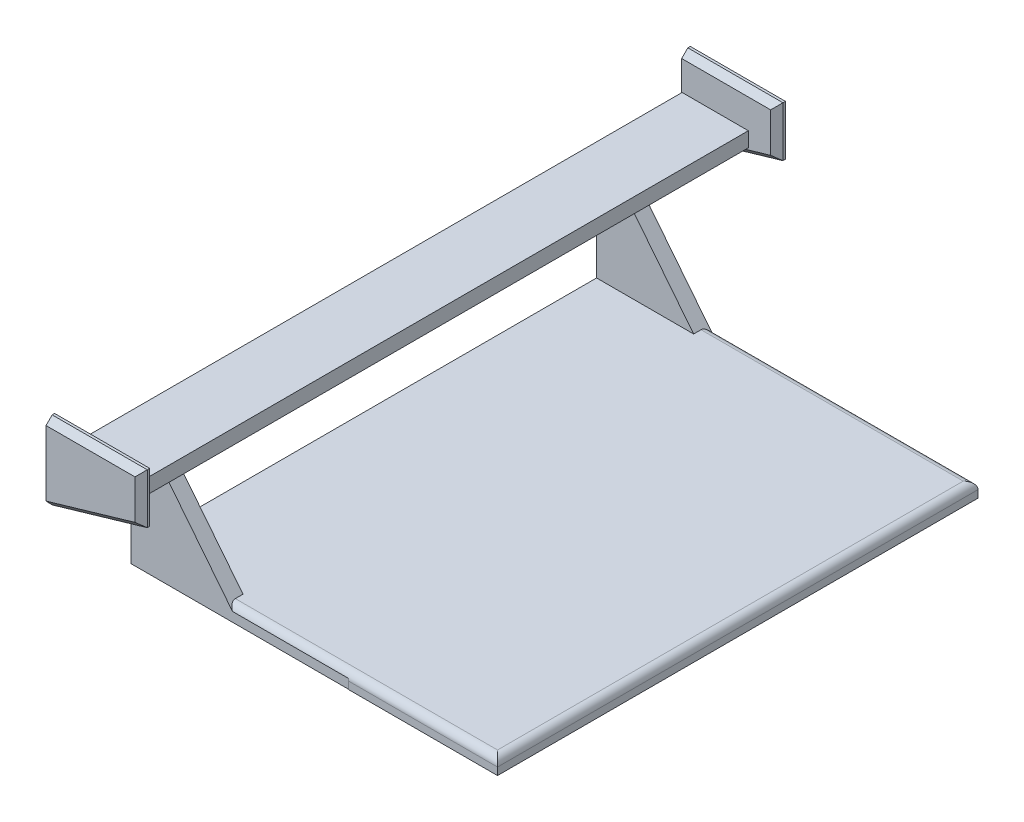
from build123d import *

# Parameters (mm, degrees)
BOSS_EXTRUDE1_DEPTH = 1.5875
BOSS_EXTRUDE3_DEPTH = 1.5875
SKETCH9_W           = 7.115403393296309
SKETCH9_H           = 66.67028171012657
BOSS_EXTRUDE4_DEPTH = 1.5875
BOSS_EXTRUDE5_DEPTH = 1.5875
CHAMFER1_SIZE       = 0.6614583333333334
CHAMFER2_SIZE       = 0.6614583333333334
BOSS_EXTRUDE6_DEPTH = 1.5875
FILLET5_R           = 0.79375


with BuildPart() as part:
    # 3DSketch3 → Boss-Extrude1 (new body)
    with BuildSketch(Plane(origin=(11.684, 0, 25.781), x_dir=(-0.41278854058734626, 0, -0.910826888469905), z_dir=(0, 1, 0))):
        Polygon((0, 0), (9.646042616445111, 21.284202729764747), (56.61009863973035, 0), (46.96405602328524, -21.284202729764747), align=None)
    extrude(amount=BOSS_EXTRUDE1_DEPTH)

    # Sketch1 → Boss-Extrude3 (add)
    with BuildSketch(Plane.XY.offset(25.781)):
        Polygon((-3.47e-15, 0), (-10.08001412814663, 12.7), (-11.684000000000005, 12.7), (-11.684000000000005, 0), align=None)
    boss_extrude3 = extrude(amount=-BOSS_EXTRUDE3_DEPTH)

    # Mirror2: Boss-Extrude3 across plane
    add(boss_extrude3.mirror(Plane.XY))

    # Sketch9 → Boss-Extrude4 (add)
    with BuildSketch(Plane(origin=(0, 12.7, 0), x_dir=(1, 0, 0), z_dir=(0, 1, 0))):
        with Locations((-8.083759928300761, 0)):
            Rectangle(SKETCH9_W, SKETCH9_H)
    extrude(amount=BOSS_EXTRUDE4_DEPTH)

    # Sketch10 → Boss-Extrude5 (add)
    with BuildSketch(Plane.XY.offset(33.33514085506329)):
        Polygon((-11.684000000000005, 9.710531383967755), (-11.684000000000005, 18.08556377199017), (-1.4701183607090107, 18.08556377199017), (-1.4701183607090107, 12.7), align=None)
    boss_extrude5 = extrude(amount=BOSS_EXTRUDE5_DEPTH)

    # Chamfer1
    chamfer1_edges = [part.edges().sort_by_distance(p)[0] for p in [
        (-1.4701183607090107, 15.392781885995085, 33.33514085506329),
        (-6.5770591803545075, 11.205265691983877, 33.33514085506329),
        (-6.5770591803545075, 18.08556377199017, 33.33514085506329),
        (-1.4701183607090107, 15.392781885995085, 34.922640855063285),
        (-6.5770591803545075, 18.08556377199017, 34.922640855063285),
        (-6.5770591803545075, 11.205265691983877, 34.922640855063285),
    ]]
    chamfer(chamfer1_edges, length=CHAMFER1_SIZE)

    # Mirror4: Boss-Extrude5 across plane
    add(boss_extrude5.mirror(Plane.XY))

    # Chamfer2
    chamfer2_edges = [part.edges().sort_by_distance(p)[0] for p in [
        (-1.4701183607090107, 15.392781885995085, -33.33514085506329),
        (-6.5770591803545075, 11.205265691983877, -33.33514085506329),
        (-6.5770591803545075, 18.08556377199017, -33.33514085506329),
        (-1.4701183607090107, 15.392781885995085, -34.922640855063285),
        (-6.5770591803545075, 11.205265691983877, -34.922640855063285),
        (-6.5770591803545075, 18.08556377199017, -34.922640855063285),
    ]]
    chamfer(chamfer2_edges, length=CHAMFER2_SIZE)

    # Sketch12 → Boss-Extrude6 (add)
    with BuildSketch(Plane(origin=(0, 0, 0), x_dir=(1, 0, 0), z_dir=(0, 1, 0))):
        Polygon((11.684, 25.781), (27.685999999999996, 25.781), (27.686000000000003, -25.810245145350073), (11.684, -25.810245145350073), align=None)
    extrude(amount=BOSS_EXTRUDE6_DEPTH)

    # Fillet5
    fillet5_edges = [part.edges().sort_by_distance(p)[0] for p in [
        (19.685000000000002, 1.5875, 25.810245145350073),
        (13.212999116990831, 1.5875, -25.781),
        (27.686, 1.5875, 0.0146225726750373),
    ]]
    fillet(fillet5_edges, radius=FILLET5_R)


solid = part.part
